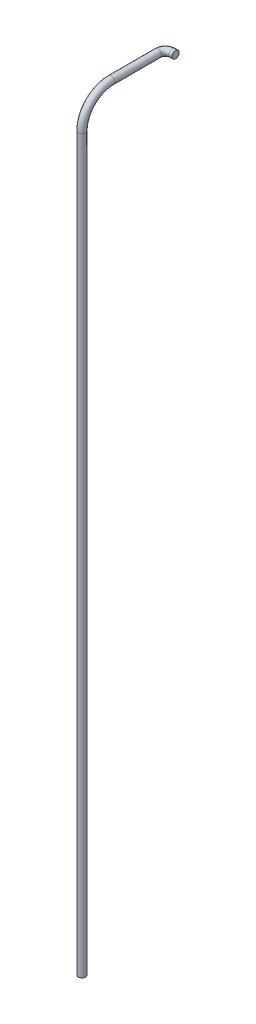
from build123d import *

# Parameters (mm, degrees)
VARREDURA1_PROFILE_R = 2.5
VARREDURA2_PROFILE_R = 2.5


with BuildPart() as part:
    # Varredura1: sweep along a path in Esboço1
    with BuildLine(Plane(origin=(0, 0, 0), x_dir=(0, 0, -1), z_dir=(1, 0, 0))) as varredura1_path:
        Line((0, 0), (-30, 0))
        ThreePointArc((-30, 0), (-44.142135624, -5.857864376), (-50, -20))
        Line((-50, -20), (-50, -520))
    # Varredura1 profile (on start of the path) → Varredura1 (sweep)
    with BuildSketch(Plane(origin=(0, 0, 0), x_dir=(0, 1, 0), z_dir=(0, 0, 1))):
        Circle(VARREDURA1_PROFILE_R)
    sweep(path=varredura1_path.line)

    # Varredura2: sweep along a path in Esboço22
    with BuildLine(Plane(origin=(0, 0, 0), x_dir=(1, 0, 0), z_dir=(0, 1, 0))) as varredura2_path:
        Line((0, 0), (0, 2))
        ThreePointArc((0, 2), (1.464466094, 5.535533906), (5, 7))
        Line((5, 7), (6.99658834, 7))
    # Varredura2 profile (on start of the path) → Varredura2 (sweep)
    with BuildSketch(Plane(origin=(0, 0, 0), x_dir=(-1, 0, 0), z_dir=(0, 0, -1))):
        Circle(VARREDURA2_PROFILE_R)
    sweep(path=varredura2_path.line)


solid = part.part
